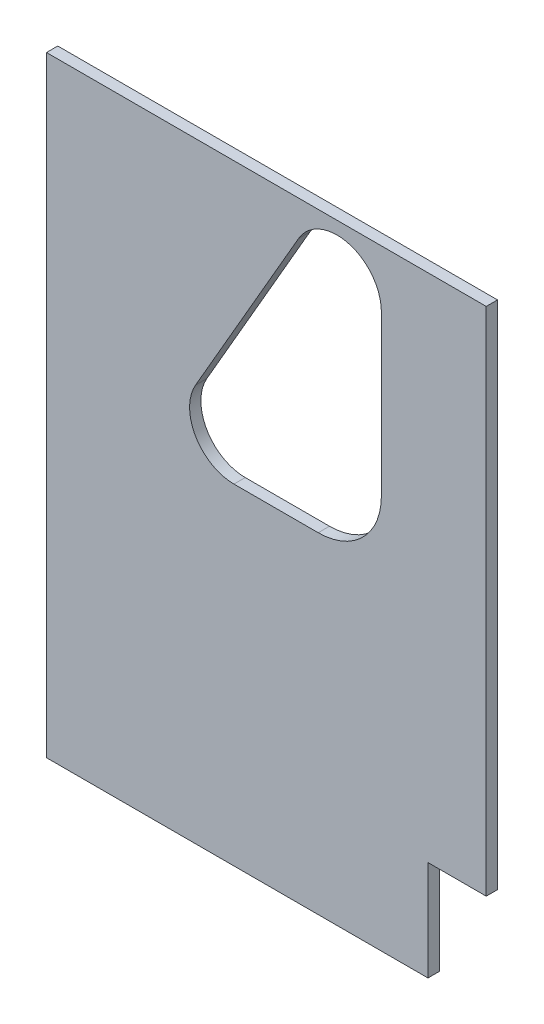
from build123d import *

# Parameters (mm, degrees)
BOSS_EXTRUDE1_DEPTH = 30
CUT_EXTRUDE1_DEPTH  = 2109.570619983


with BuildPart() as part:
    # Sketch1 → Boss-Extrude1 (new body)
    with BuildSketch(Plane.XY):
        Polygon((0, 0), (1015, 0), (1015, 266), (1170, 266), (1170, 1625), (0, 1625), align=None)
    extrude(amount=BOSS_EXTRUDE1_DEPTH)

    # Sketch2 → Cut-Extrude1 (cut, through all)
    with BuildSketch(Plane(origin=(-119.436638294, -43.071405931, 31), x_dir=(1, 0, 0), z_dir=(0, 0, 1))):
        with BuildLine():
            Line((1010.436638294, 1516.071405931), (1010.436638294, 1091.071405931))
            ThreePointArc((1010.436638294, 1091.071405931), (961.230577533, 972.277466691), (842.436638294, 923.071405931))
            Line((842.436638294, 923.071405931), (618.195260429, 923.071405931))
            ThreePointArc((618.195260429, 923.071405931), (516.004262782, 982.071405931), (516.004262782, 1100.071405931))
            Line((516.004262782, 1100.071405931), (790.245640647, 1575.071405931))
            ThreePointArc((790.245640647, 1575.071405931), (922.977285616, 1630.050653433), (1010.436638294, 1516.071405931))
        make_face()
    extrude(amount=-CUT_EXTRUDE1_DEPTH, mode=Mode.SUBTRACT)


solid = part.part
